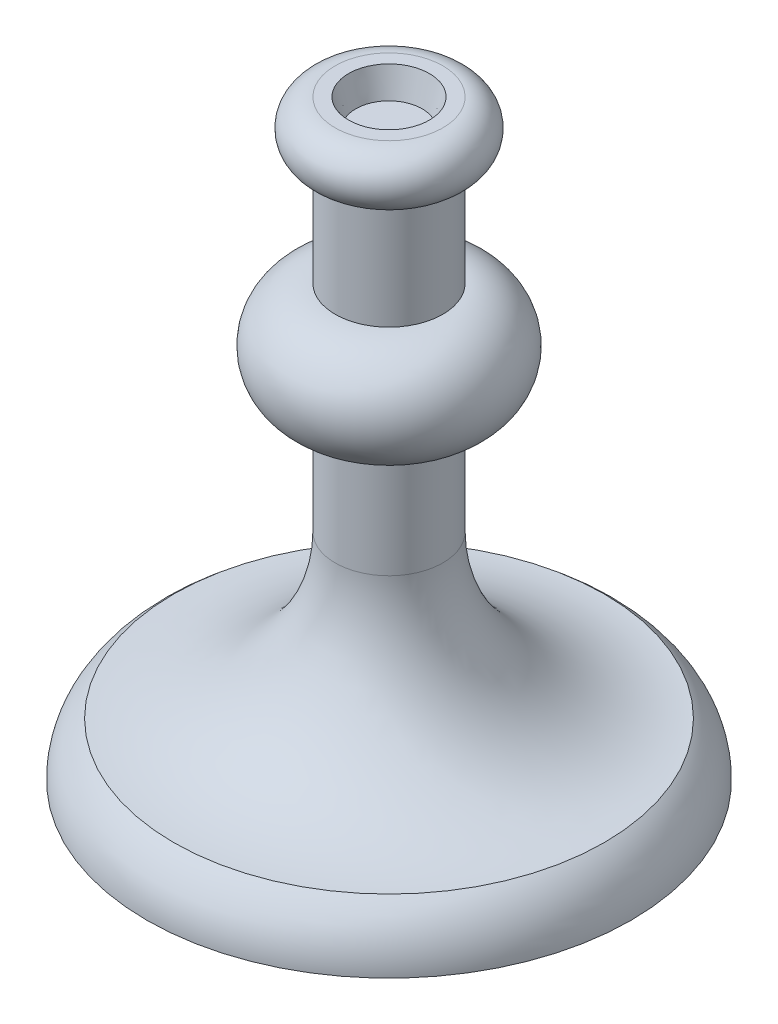
from build123d import *

# Parameters (mm, degrees)
SKETCH3_R          = 15
CUT_EXTRUDE1_DEPTH = 10
CUT_EXTRUDE1_DRAFT = -15


with BuildPart() as part:
    # Sketch1 → Revolve1 (revolve)
    with BuildSketch(Plane.XY, mode=Mode.PRIVATE) as revolve1_sk:
        with BuildLine():
            Line((0, 0), (0, 220))
            Line((0, 220), (20, 220))
            ThreePointArc((20, 220), (30, 210), (20, 200))
            Line((20, 200), (20, 160))
            ThreePointArc((20, 160), (40, 140), (20, 120))
            Line((20, 120), (20, 80))
            ThreePointArc((20, 80), (37.573593129, 37.573593129), (80, 20))
            ThreePointArc((80, 20), (87.360679775, 11.180339887), (90, 0))
            Line((90, 0), (0, 0))
        make_face()
    revolve(revolve1_sk.sketch.rotate(Axis((0, 0, 0), (0, 1, 0)), 90), axis=Axis((0, 0, 0), (0, 1, 0)))


with BuildPart() as cut_extrude1_tool:
    # Sketch3 → Cut-Extrude1 (with draft: the straight prism first)
    with BuildSketch(Plane(origin=(0, 220, 0), x_dir=(1, 0, 0), z_dir=(0, 1, 0))):
        Circle(SKETCH3_R)
    extrude(amount=-CUT_EXTRUDE1_DEPTH)
    # Cut-Extrude1: the draft: its side faces are tilted about the plane it starts from
    cut_extrude1_sides = [cut_extrude1_tool.faces().sort_by_distance(p)[0] for p in [
        (-15, 215, 0),
    ]]
    draft(cut_extrude1_sides, Plane(origin=(0, 220, 0), x_dir=(1, 0, 0), z_dir=(0, 1, 0)), CUT_EXTRUDE1_DRAFT)


with BuildPart() as part_1:
    add(part.part)

    # Cut-Extrude1: cut by cut_extrude1_tool
    add(cut_extrude1_tool.part, mode=Mode.SUBTRACT)


solid = part_1.part
